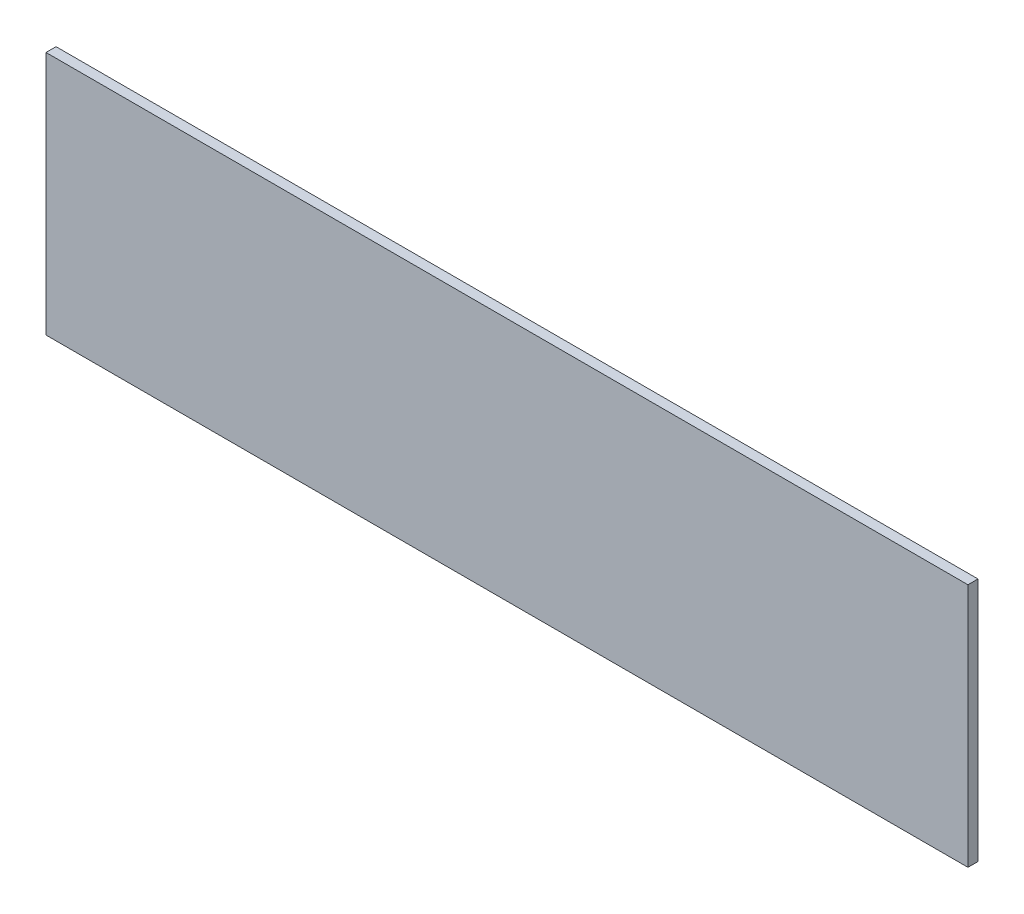
from build123d import *

# Parameters (mm, degrees)
CROQUIS1_W              = 275
CROQUIS1_H              = 73
SALIENTE_EXTRUIR1_DEPTH = 3


with BuildPart() as part:
    # Croquis1 → Saliente-Extruir1 (new body)
    with BuildSketch(Plane.XY):
        Rectangle(CROQUIS1_W, CROQUIS1_H)
    extrude(amount=SALIENTE_EXTRUIR1_DEPTH)


solid = part.part
